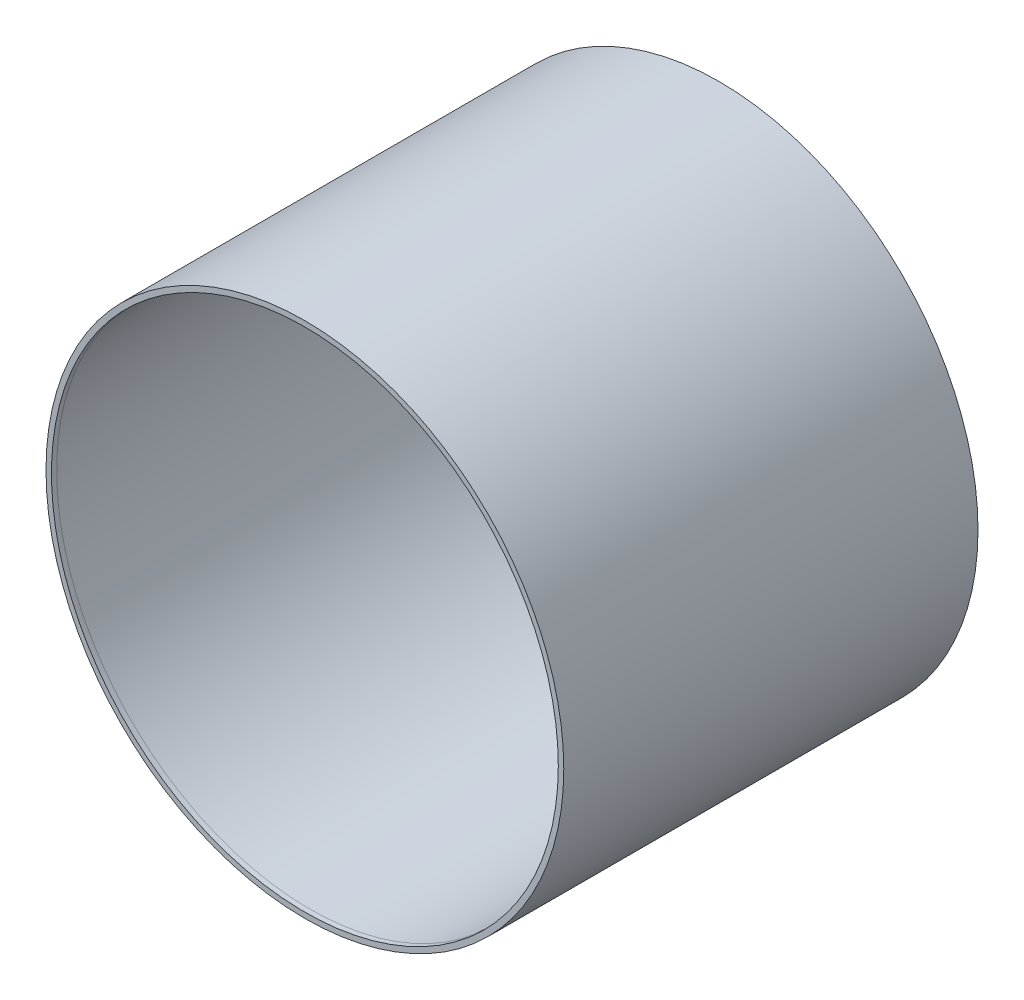
from build123d import *

# Parameters (mm, degrees)
SKETCH_1_R          = 50
EXTRUDE_1_DEPTH     = 80
SHELL_1_T           = -1
SKETCH_2_R          = 48.945
CUT_EXTRUDE_1_DEPTH = 1


with BuildPart() as part:
    # 草图1 → 凸台-拉伸1 (new body)
    with BuildSketch(Plane.XY):
        Circle(SKETCH_1_R)
    extrude(amount=EXTRUDE_1_DEPTH)

    # 抽壳1
    shell_1_openings = [part.faces().sort_by_distance(p)[0] for p in [
        (0, 0, 0),
    ]]
    offset(amount=SHELL_1_T, openings=shell_1_openings, kind=Kind.INTERSECTION)

    # 草图2 → 切除-拉伸1 (cut)
    with BuildSketch(Plane.XY.offset(80)):
        Circle(SKETCH_2_R)
    extrude(amount=-CUT_EXTRUDE_1_DEPTH, mode=Mode.SUBTRACT)


solid = part.part
